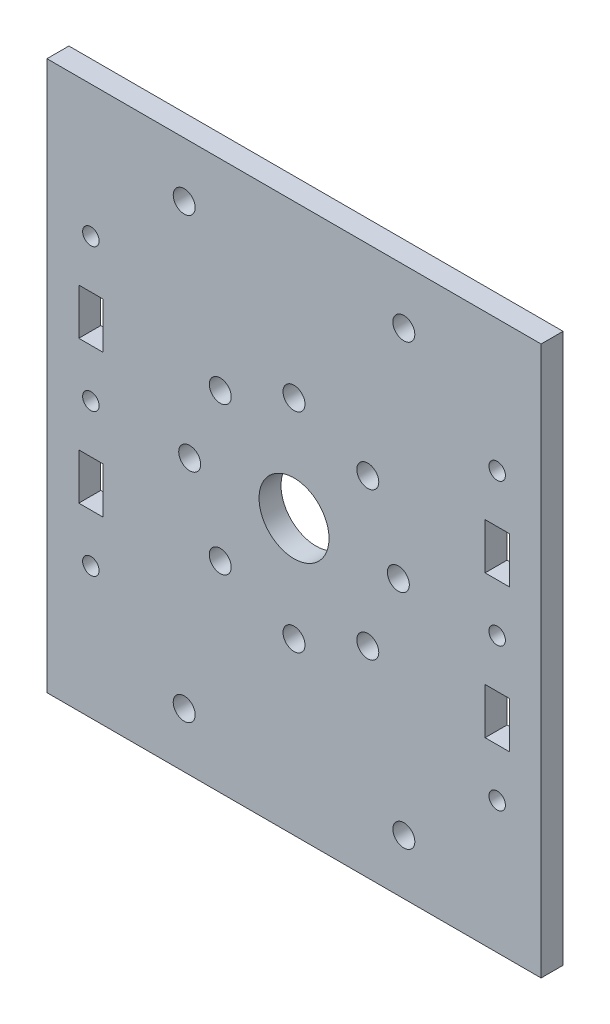
from build123d import *

# Parameters (mm, degrees)
SKETCH_1_W      = 90
SKETCH_1_H      = 100
SKETCH_1_R      = 6.372546474
SKETCH_1_R_2    = 2
SKETCH_1_R_3    = 1.5
SKETCH_1_W_2    = 4.4
SKETCH_1_H_2    = 8.4
EXTRUDE_1_DEPTH = 4


with BuildPart() as part:
    # 草图1 → 凸台-拉伸1 (new body)
    with BuildSketch(Plane.XY):
        Rectangle(SKETCH_1_W, SKETCH_1_H)
        Circle(SKETCH_1_R, mode=Mode.SUBTRACT)
        with Locations((0, -19)):
            Circle(SKETCH_1_R_2, mode=Mode.SUBTRACT)
        with Locations((-13.435028843, -13.435028843)):
            Circle(SKETCH_1_R_2, mode=Mode.SUBTRACT)
        with Locations((-19, 0)):
            Circle(SKETCH_1_R_2, mode=Mode.SUBTRACT)
        with Locations((-13.435028843, 13.435028843)):
            Circle(SKETCH_1_R_2, mode=Mode.SUBTRACT)
        with Locations((0, 19)):
            Circle(SKETCH_1_R_2, mode=Mode.SUBTRACT)
        with Locations((13.435028843, 13.435028843)):
            Circle(SKETCH_1_R_2, mode=Mode.SUBTRACT)
        with Locations((19, 0)):
            Circle(SKETCH_1_R_2, mode=Mode.SUBTRACT)
        with Locations((13.435028843, -13.435028843)):
            Circle(SKETCH_1_R_2, mode=Mode.SUBTRACT)
        with Locations((-20, -40)):
            Circle(SKETCH_1_R_2, mode=Mode.SUBTRACT)
        with Locations((20, -40)):
            Circle(SKETCH_1_R_2, mode=Mode.SUBTRACT)
        with Locations(Location((20, 40, 0), (0, 0, 180))):
            Circle(SKETCH_1_R_2, mode=Mode.SUBTRACT)
        with Locations(Location((-20, 40, 0), (0, 0, 180))):
            Circle(SKETCH_1_R_2, mode=Mode.SUBTRACT)
        with Locations((37, 0)):
            Circle(SKETCH_1_R_3, mode=Mode.SUBTRACT)
        with Locations((37, 26)):
            Circle(SKETCH_1_R_3, mode=Mode.SUBTRACT)
        with Locations(Location((37, -26, 0), (0, 0, 180))):
            Circle(SKETCH_1_R_3, mode=Mode.SUBTRACT)
        with Locations(Location((-37, 0, 0), (0, 0, 180))):
            Circle(SKETCH_1_R_3, mode=Mode.SUBTRACT)
        with Locations((-37, -26)):
            Circle(SKETCH_1_R_3, mode=Mode.SUBTRACT)
        with Locations(Location((-37, 26, 0), (0, 0, 180))):
            Circle(SKETCH_1_R_3, mode=Mode.SUBTRACT)
        with Locations((37, -13)):
            Rectangle(SKETCH_1_W_2, SKETCH_1_H_2, mode=Mode.SUBTRACT)
        with Locations((37, 13)):
            Rectangle(SKETCH_1_W_2, SKETCH_1_H_2, mode=Mode.SUBTRACT)
        with Locations((-37, 13)):
            Rectangle(SKETCH_1_W_2, SKETCH_1_H_2, mode=Mode.SUBTRACT)
        with Locations((-37, -13)):
            Rectangle(SKETCH_1_W_2, SKETCH_1_H_2, mode=Mode.SUBTRACT)
    extrude(amount=EXTRUDE_1_DEPTH)


solid = part.part
